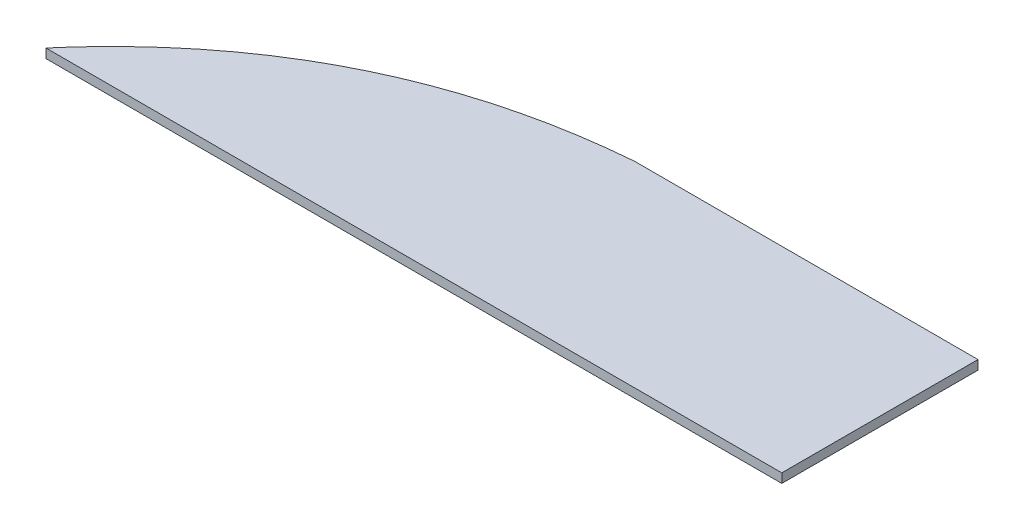
from build123d import *

# Parameters (mm, degrees)
SKETCH1_W               = 381
SKETCH1_H               = 101.6
BOSS_EXTRUDE1_DEPTH     = 4.7625
CUT_EXTRUDE1_DEPTH      = 395.342796823
CUT_EXTRUDE1_DEPTH_BACK = 395.342796823


with BuildPart() as part:
    # Sketch1 → Boss-Extrude1 (new body)
    with BuildSketch(Plane(origin=(0, 0, 0), x_dir=(1, 0, 0), z_dir=(0, 1, 0))):
        with Locations((190.5, 50.8)):
            Rectangle(SKETCH1_W, SKETCH1_H)
    extrude(amount=BOSS_EXTRUDE1_DEPTH)

    # Sketch2 → Cut-Extrude1 (cut, two sides: drawn at the far end of the back side and taken through both)
    with BuildSketch(Plane(origin=(0, 4.7625, 0), x_dir=(1, 0, 0), z_dir=(0, 1, 0)).offset(-CUT_EXTRUDE1_DEPTH_BACK)):
        with BuildLine():
            Line((0, 0), (0, 101.6))
            Line((0, 101.6), (203.2, 101.6))
            add(Edge.make_bspline(
                [(0, 0), (78.279347672, 91.49115187), (203.2, 101.6)],
                knots=[0, 0, 0, 1, 1, 1], degree=2))
        make_face()
    extrude(amount=CUT_EXTRUDE1_DEPTH + CUT_EXTRUDE1_DEPTH_BACK, mode=Mode.SUBTRACT)


solid = part.part
